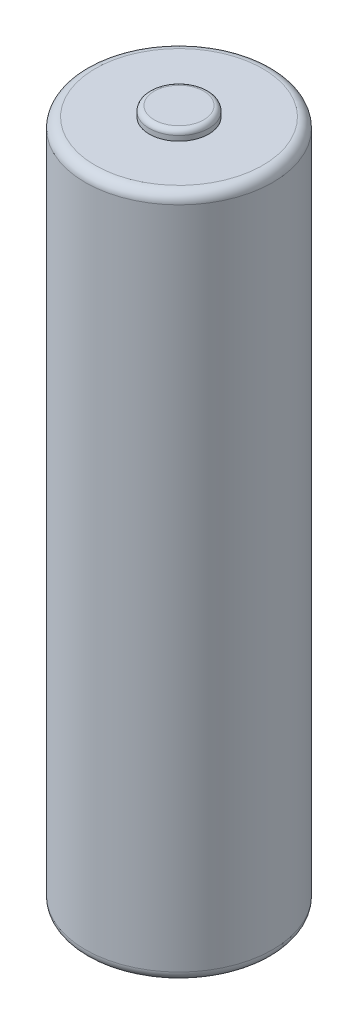
from build123d import *

# Parameters (mm, degrees)
BOSS_EXTRUDE1_DEPTH      = 35
BOSS_EXTRUDE1_DEPTH_BACK = 35
SKETCH1_R                = 9.45
SKETCH2_R                = 9.45
SKETCH2_R_2              = 3
CUT_EXTRUDE1_DEPTH       = 1
FILLET1_R                = 0.5
FILLET2_R                = 1


with BuildPart() as part:
    # Sketch1 → Boss-Extrude1 (new, two sides: drawn at the far end of the back side and taken through both)
    with BuildSketch(Plane(origin=(0, 0, 0), x_dir=(1, 0, 0), z_dir=(0, 1, 0)).offset(-BOSS_EXTRUDE1_DEPTH_BACK)):
        with Locations(Location((0, 0, 0), (0, 0, 270))):
            Circle(SKETCH1_R)
    extrude(amount=BOSS_EXTRUDE1_DEPTH + BOSS_EXTRUDE1_DEPTH_BACK)

    # Sketch2 → Cut-Extrude1 (cut)
    with BuildSketch(Plane(origin=(0, 35, 0), x_dir=(1, 0, 0), z_dir=(0, 1, 0))):
        with Locations(Location((0, 0, 0), (0, 0, 270))):
            Circle(SKETCH2_R)
        with Locations(Location((0, 0, 0), (0, 0, 270))):
            Circle(SKETCH2_R_2, mode=Mode.SUBTRACT)
    extrude(amount=-CUT_EXTRUDE1_DEPTH, mode=Mode.SUBTRACT)

    # Fillet1
    fillet1_edges = [part.edges().sort_by_distance(p)[0] for p in [
        (0, 35, -3),
    ]]
    fillet(fillet1_edges, radius=FILLET1_R)

    # Fillet2
    fillet2_edges = [part.edges().sort_by_distance(p)[0] for p in [
        (0, -35, -9.45),
        (0, 34, -9.45),
    ]]
    fillet(fillet2_edges, radius=FILLET2_R)


solid = part.part
